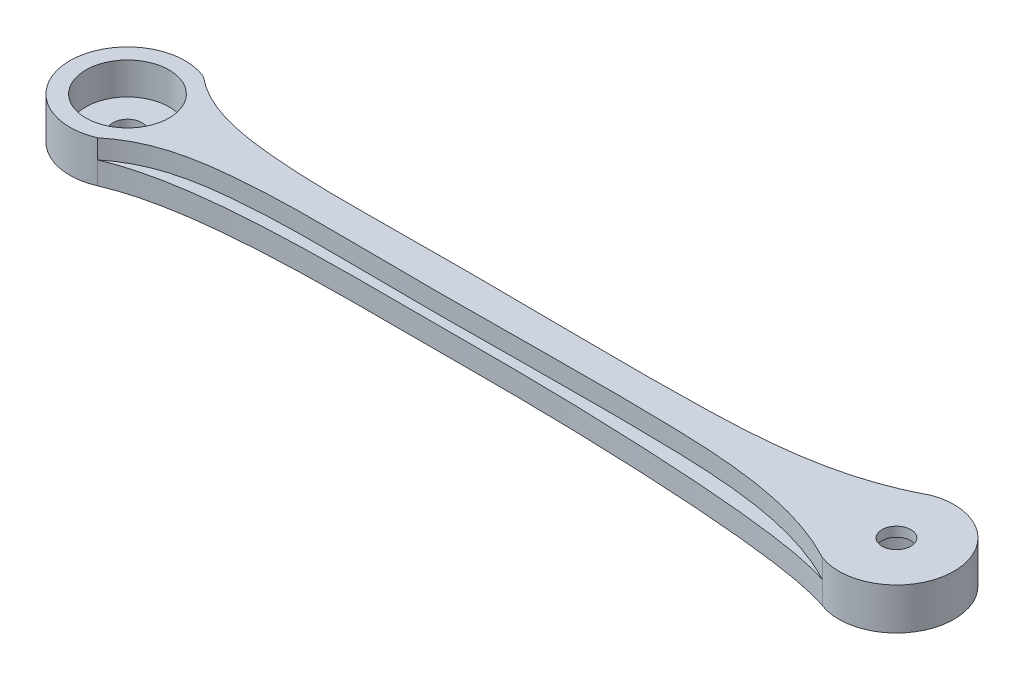
from build123d import *

# Parameters (mm, degrees)
SKETCH1_R           = 9
SKETCH1_R_2         = 2.25
BOSS_EXTRUDE1_DEPTH = 6.5
CUT_EXTRUDE1_START  = -5
SKETCH2_R           = 6.5
SKETCH2_R_2         = 2.25
CUT_EXTRUDE1_DEPTH  = 5
CUT_EXTRUDE2_DEPTH  = 3
CUT_EXTRUDE3_START  = -6.5
SKETCH2_3_R         = 6.5
CUT_EXTRUDE3_DEPTH  = 5


with BuildPart() as part:
    # Sketch1 → Boss-Extrude1 (new body)
    # profile 1 of 3: a face of its own
    with BuildSketch(Plane(origin=(0, 0, 0), x_dir=(1, 0, 0), z_dir=(0, 1, 0))):
        with Locations((-120, 0)):
            Circle(SKETCH1_R)
        with Locations(Location((-120, 0, 0), (0, 0, 90))):
            Circle(SKETCH1_R_2, mode=Mode.SUBTRACT)
    # profile 2 of 3: a face of its own
    with BuildSketch(Plane(origin=(0, 0, 0), x_dir=(1, 0, 0), z_dir=(0, 1, 0))):
        with BuildLine():
            ThreePointArc((-116.409605108, 8.252821609), (-112.472930383, 4.933885182), (-111, 0))
            ThreePointArc((-111, 0), (-112.472930383, -4.933885182), (-116.409605108, -8.252821609))
            add(Edge.make_bspline(
                [(-116.409605108, -8.252821609), (-105.478903695, -3.497413535), (-80.532354503, -4.12846793), (-45.700894509, -3.892627812), (-12.04915124, -5.208001503), (-3.064915464, -8.462050177)],
                knots=[0, 0, 0, 0, 0.514412912, 0.614412912, 1, 1, 1, 1], degree=3))
            ThreePointArc((-3.064915464, -8.462050177), (-9, 0), (-3.064915464, 8.462050177))
            add(Edge.make_bspline(
                [(-116.409605108, 8.252821609), (-105.478903695, 3.497413535), (-80.532354503, 4.12846793), (-45.700894509, 3.892627812), (-12.04915124, 5.208001503), (-3.064915464, 8.462050177)],
                knots=[0, 0, 0, 0, 0.514412912, 0.614412912, 1, 1, 1, 1], degree=3))
        make_face()
    # profile 3 of 3: a face of its own
    with BuildSketch(Plane(origin=(0, 0, 0), x_dir=(1, 0, 0), z_dir=(0, 1, 0))):
        Circle(SKETCH1_R)
        with Locations(Location((0, 0, 0), (0, 0, 90))):
            Circle(SKETCH1_R_2, mode=Mode.SUBTRACT)
    extrude(amount=BOSS_EXTRUDE1_DEPTH)

    # Sketch2 → Cut-Extrude1 (cut)
    with BuildSketch(Plane(origin=(0, 6.5, 0), x_dir=(1, 0, 0), z_dir=(0, 1, 0)).offset(CUT_EXTRUDE1_START)):
        with Locations(Location((-120, 0, 0), (0, 0, 270))):
            Circle(SKETCH2_R)
        with Locations(Location((-120, 0, 0), (0, 0, 90))):
            Circle(SKETCH2_R_2, mode=Mode.SUBTRACT)
    extrude(amount=CUT_EXTRUDE1_DEPTH, mode=Mode.SUBTRACT)

    # Sketch3 → Cut-Extrude2 (cut)
    with BuildSketch(Plane(origin=(0, 6.5, 0), x_dir=(1, 0, 0), z_dir=(0, 1, 0))):
        with BuildLine():
            add(Edge.make_bspline(
                [(-116.409605108, -8.252821609), (-111.926525136, -4.515073542), (-103.615159098, -3.007845736), (-91.22070001, -2.347255299), (-77.849021373, -2.568456126), (-58.009603755, -2.53414615), (-32.098488239, -2.117697646), (-12.442081893, -3.452077228), (-3.064915464, -8.462050177)],
                knots=[0, 0, 0, 0, 0.145433364, 0.214931865, 0.323765467, 0.493222335, 0.731337307, 1, 1, 1, 1], degree=3))
            add(Edge.make_bspline(
                [(-116.409605108, -8.252821609), (-105.478903695, -3.497413535), (-80.532354503, -4.12846793), (-45.700894509, -3.892627812), (-12.04915124, -5.208001503), (-3.064915464, -8.462050177)],
                knots=[0, 0, 0, 0, 0.514412912, 0.614412912, 1, 1, 1, 1], degree=3))
        make_face()
        with BuildLine():
            add(Edge.make_bspline(
                [(-116.409605108, 8.252821609), (-111.926525136, 4.515073542), (-103.615159098, 3.007845736), (-91.22070001, 2.347255299), (-77.849021373, 2.568456126), (-58.009603755, 2.53414615), (-32.098488239, 2.117697646), (-12.442081893, 3.452077228), (-3.064915464, 8.462050177)],
                knots=[0, 0, 0, 0, 0.145433364, 0.214931865, 0.323765467, 0.493222335, 0.731337307, 1, 1, 1, 1], degree=3))
            add(Edge.make_bspline(
                [(-3.064915464, 8.462050177), (-12.04915124, 5.208001503), (-45.700894509, 3.892627812), (-80.532354503, 4.12846793), (-105.478903695, 3.497413535), (-116.409605108, 8.252821609)],
                knots=[0, 0, 0, 0, 0.385587088, 0.485587088, 1, 1, 1, 1], degree=3))
        make_face()
    extrude(amount=-CUT_EXTRUDE2_DEPTH, mode=Mode.SUBTRACT)

    # Sketch2<3> → Cut-Extrude3 (cut)
    with BuildSketch(Plane(origin=(0, 6.5, 0), x_dir=(1, 0, 0), z_dir=(0, 1, 0)).offset(CUT_EXTRUDE3_START)):
        with Locations(Location((0, 0, 0), (0, 0, 270))):
            Circle(SKETCH2_3_R)
    extrude(amount=CUT_EXTRUDE3_DEPTH, mode=Mode.SUBTRACT)


solid = part.part
